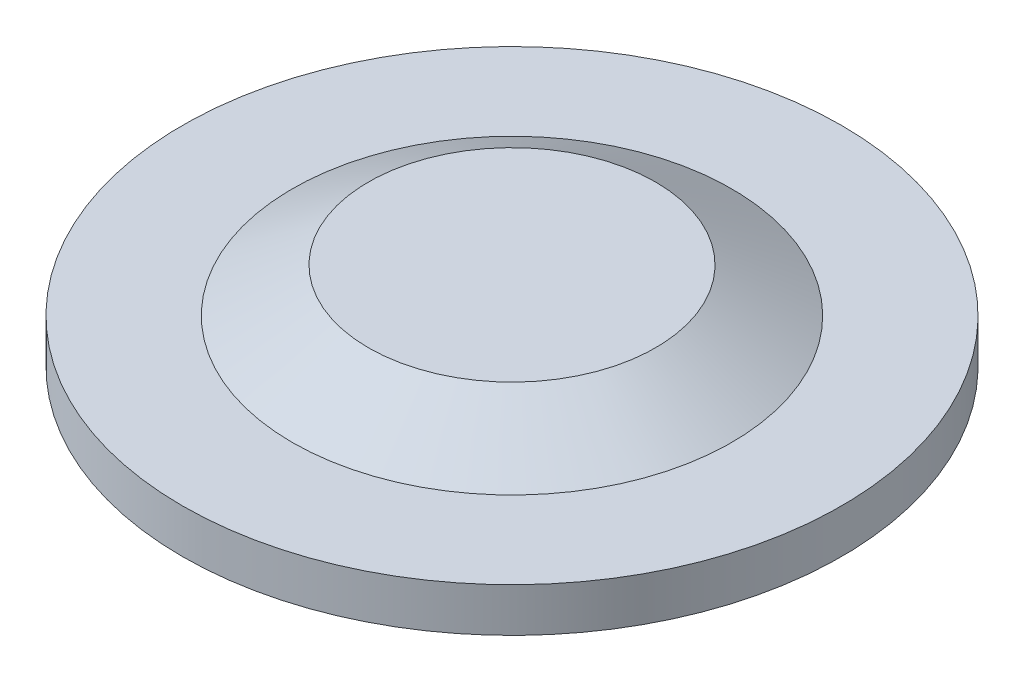
from build123d import *

# Parameters (mm, degrees)
SKETCH2_R           = 5.715
BOSS_EXTRUDE1_DEPTH = 0.762
SKETCH3_R           = 3.81
BOSS_EXTRUDE2_DEPTH = 0.762
BOSS_EXTRUDE2_TAPER = 60


with BuildPart() as part:
    # Sketch2 → Boss-Extrude1 (new body)
    with BuildSketch(Plane(origin=(0, 0, 0), x_dir=(1, 0, 0), z_dir=(0, 1, 0))):
        with Locations(Location((0, 0, 0), (0, 0, 90))):
            Circle(SKETCH2_R)
    extrude(amount=BOSS_EXTRUDE1_DEPTH)

    # Sketch3 → Boss-Extrude2 (add)
    with BuildSketch(Plane(origin=(0, 0.762, 0), x_dir=(1, 0, 0), z_dir=(0, 1, 0))):
        Circle(SKETCH3_R)
    extrude(amount=BOSS_EXTRUDE2_DEPTH, taper=BOSS_EXTRUDE2_TAPER)


solid = part.part
